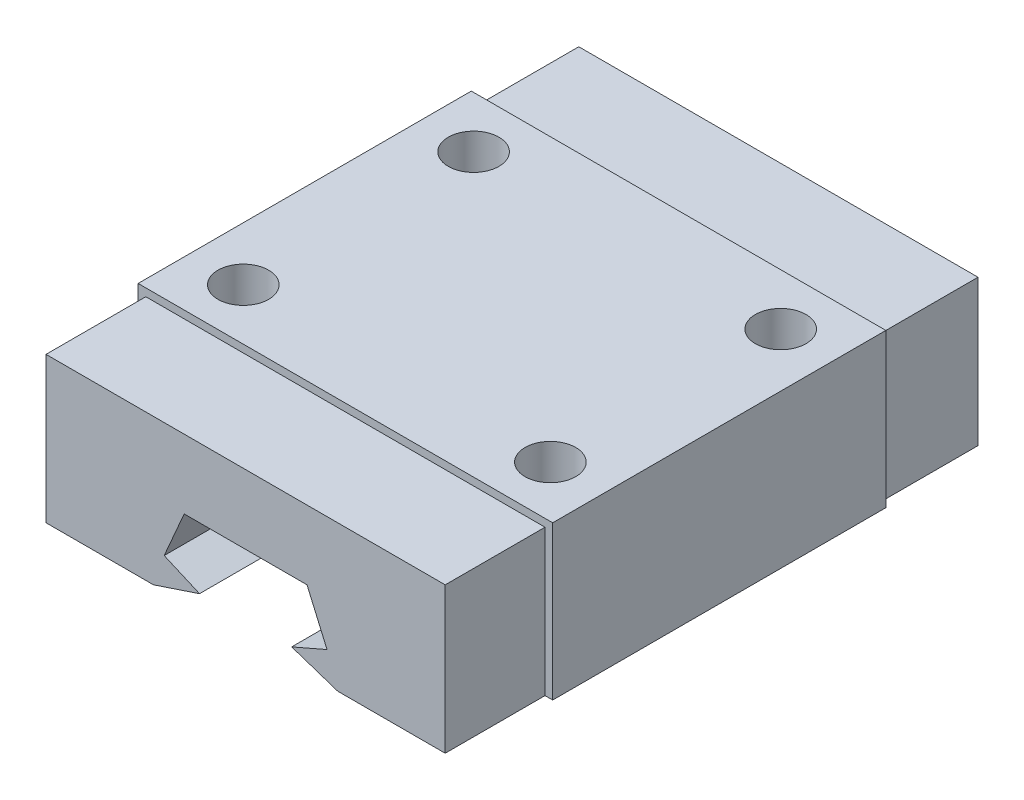
from build123d import *

# Parameters (mm, degrees)
SKETCH_1_W              = 27
SKETCH_1_H              = 21.7
EXTRUDE_1_DEPTH         = 10
SKETCH_2_W              = 26
SKETCH_2_H              = 9.5
EXTRUDE_2_DEPTH         = 6.5
SKETCH_3_W              = 26
SKETCH_3_H              = 9.5
EXTRUDE_3_DEPTH         = 6.5
CUT_EXTRUDE_1_DEPTH     = 38.567805366
DRAFT_1_ANGLE           = 23.473307954
HOLE_WIZARD_3_3_3_3_1_D = 3.3


with BuildPart() as part:
    # 草图1 → 凸台-拉伸1 (new body)
    with BuildSketch(Plane.XZ.offset(5)):
        Rectangle(SKETCH_1_W, SKETCH_1_H)
    extrude(amount=-EXTRUDE_1_DEPTH)

    # 草图2 → 凸台-拉伸2 (add)
    with BuildSketch(Plane.XY.offset(10.85)):
        with Locations((0, -0.25)):
            Rectangle(SKETCH_2_W, SKETCH_2_H)
    extrude(amount=EXTRUDE_2_DEPTH)

    # 草图3 → 凸台-拉伸3 (add)
    with BuildSketch(Plane(origin=(0, 0, -10.85), x_dir=(-1, 0, 0), z_dir=(0, 0, -1))):
        with Locations((0, -0.25)):
            Rectangle(SKETCH_3_W, SKETCH_3_H)
    extrude(amount=EXTRUDE_3_DEPTH)

    # 草图4 → 切除-拉伸1 (cut, through all)
    with BuildSketch(Plane.XY.offset(17.35)):
        Polygon((6, -5), (3, -4), (4, -3.565741454), (4, 0), (-4, 0), (-4, -3.565741454), (-3, -4), (-6, -5), align=None)
    extrude(amount=-CUT_EXTRUDE_1_DEPTH, mode=Mode.SUBTRACT)

    # 拔模1
    draft_1_faces = [part.faces().sort_by_distance(p)[0] for p in [
        (-4, -1.782870727, 0),
        (4, -1.782870727, 0),
    ]]
    draft(draft_1_faces, Plane(origin=(4, 0, -17.35), x_dir=(-1, 0, 0), z_dir=(0, -1, 0)), DRAFT_1_ANGLE)

    # Ø3.3 (3.3) 直径孔1 (through all)
    with Locations(Plane(origin=(0, 5, 0), x_dir=(1, 0, 0), z_dir=(0, 1, 0))):
        with Locations((10, -7.5), (-10, -7.5), (-10, 7.5), (10, 7.5)):
            Hole(HOLE_WIZARD_3_3_3_3_1_D / 2)


solid = part.part
